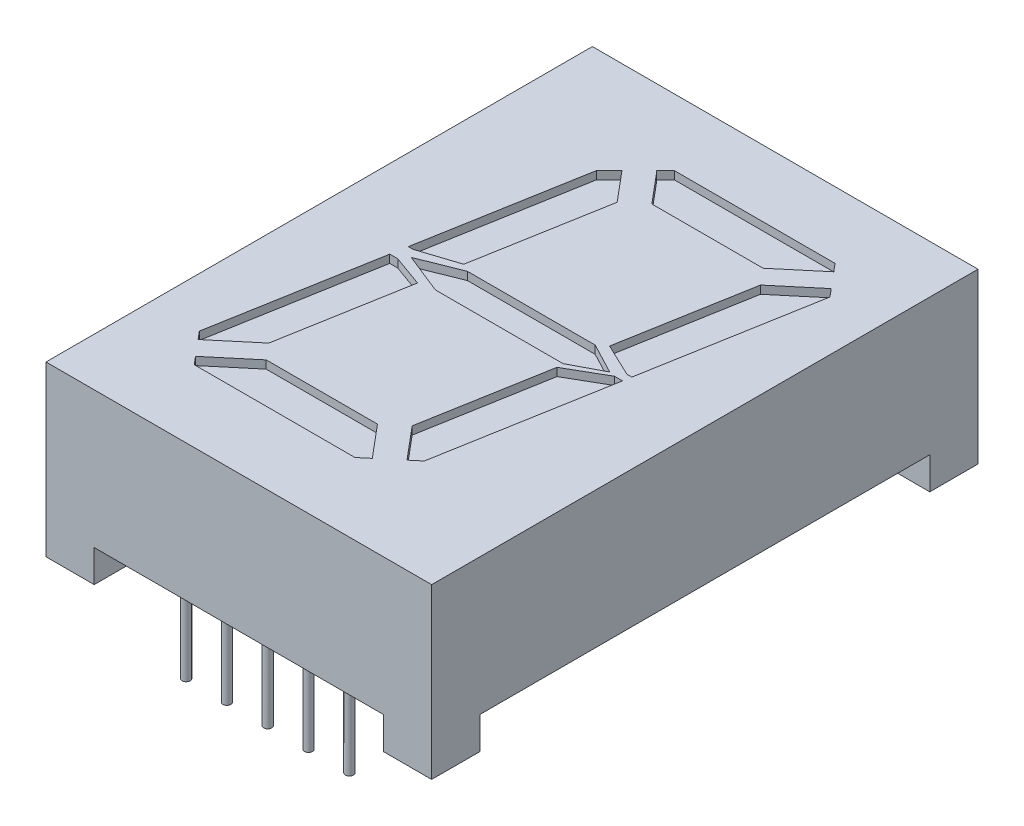
from build123d import *

# Parameters (mm, degrees)
SKETCH1_W           = 24
SKETCH1_H           = 34
BOSS_EXTRUDE1_DEPTH = 10.5
SKETCH3_R           = 0.25
BOSS_EXTRUDE2_DEPTH = 4
SKETCH4_W           = 14
SKETCH4_H           = 2
CUT_EXTRUDE1_DEPTH  = 30
SKETCH5_W           = 9
SKETCH5_H           = 2
CUT_EXTRUDE2_DEPTH  = 43
SKETCH6_R           = 0.25
BOSS_EXTRUDE3_DEPTH = 2
SKETCH7_W           = 7.945226129
SKETCH7_H           = 2
CUT_EXTRUDE3_DEPTH  = 0.5
BOSS_EXTRUDE4_DEPTH = 0.5


with BuildPart() as part:
    # Sketch1 → Boss-Extrude1 (new body)
    with BuildSketch(Plane(origin=(0, 0, 0), x_dir=(1, 0, 0), z_dir=(0, 1, 0))):
        Rectangle(SKETCH1_W, SKETCH1_H)
    extrude(amount=-BOSS_EXTRUDE1_DEPTH)

    # Sketch3 → Boss-Extrude2 (add)
    with BuildSketch(Plane.XZ.offset(10.5)):
        with Locations(Location((0, 15.2, 0), (0, 0, 270))):
            Circle(SKETCH3_R)
        with Locations(Location((0, -15.2, 0), (0, 0, 270))):
            Circle(SKETCH3_R)
        with Locations(Location((2.54, 15.2, 0), (0, 0, 270))):
            Circle(SKETCH3_R)
        with Locations(Location((5.08, 15.2, 0), (0, 0, 270))):
            Circle(SKETCH3_R)
        with Locations(Location((-2.54, 15.2, 0), (0, 0, 90))):
            Circle(SKETCH3_R)
        with Locations(Location((-5.08, 15.2, 0), (0, 0, 90))):
            Circle(SKETCH3_R)
        with Locations(Location((-5.08, -15.2, 0), (0, 0, 270))):
            Circle(SKETCH3_R)
        with Locations(Location((-2.54, -15.2, 0), (0, 0, 270))):
            Circle(SKETCH3_R)
        with Locations(Location((2.54, -15.2, 0), (0, 0, 90))):
            Circle(SKETCH3_R)
        with Locations(Location((5.08, -15.2, 0), (0, 0, 90))):
            Circle(SKETCH3_R)
    extrude(amount=BOSS_EXTRUDE2_DEPTH)

    # Sketch4 → Cut-Extrude1 (cut)
    with BuildSketch(Plane(origin=(12, 0, 0), x_dir=(0, 0, -1), z_dir=(1, 0, 0))):
        with Locations((-7, -9.5)):
            Rectangle(SKETCH4_W, SKETCH4_H)
        with Locations((7, -9.5)):
            Rectangle(SKETCH4_W, SKETCH4_H)
    extrude(amount=-CUT_EXTRUDE1_DEPTH, mode=Mode.SUBTRACT)

    # Sketch5 → Cut-Extrude2 (cut)
    with BuildSketch(Plane.XY.offset(17)):
        with Locations((4.5, -9.5)):
            Rectangle(SKETCH5_W, SKETCH5_H)
        with Locations((-4.5, -9.5)):
            Rectangle(SKETCH5_W, SKETCH5_H)
    extrude(amount=-CUT_EXTRUDE2_DEPTH, mode=Mode.SUBTRACT)


with BuildPart() as cut_extrude2_piece_1:
    # of the separate pieces the step leaves, piece 1, a body of its own (cut_extrude2_pieces)
    add(part.part.solids().sort_by_distance((-12, 0, -17))[0])



with BuildPart() as cut_extrude2_piece_2:
    # of the separate pieces the step leaves, piece 2, a body of its own (cut_extrude2_pieces)
    add(part.part.solids().sort_by_distance((5.08, -10.5, -14.95))[0])


with BuildPart() as cut_extrude2_piece_3:
    # of the separate pieces the step leaves, piece 3, a body of its own (cut_extrude2_pieces)
    add(part.part.solids().sort_by_distance((-5.08, -10.5, -15.45))[0])


with BuildPart() as cut_extrude2_piece_4:
    # of the separate pieces the step leaves, piece 4, a body of its own (cut_extrude2_pieces)
    add(part.part.solids().sort_by_distance((5.08, -10.5, 14.95))[0])


with BuildPart() as cut_extrude2_piece_5:
    # of the separate pieces the step leaves, piece 5, a body of its own (cut_extrude2_pieces)
    add(part.part.solids().sort_by_distance((-5.08, -10.5, 15.45))[0])


with BuildPart() as cut_extrude2_piece_6:
    # of the separate pieces the step leaves, piece 6, a body of its own (cut_extrude2_pieces)
    add(part.part.solids().sort_by_distance((0, -10.5, -15.45))[0])


with BuildPart() as cut_extrude2_piece_7:
    # of the separate pieces the step leaves, piece 7, a body of its own (cut_extrude2_pieces)
    add(part.part.solids().sort_by_distance((2.54, -10.5, -14.95))[0])


with BuildPart() as cut_extrude2_piece_8:
    # of the separate pieces the step leaves, piece 8, a body of its own (cut_extrude2_pieces)
    add(part.part.solids().sort_by_distance((-2.54, -10.5, -15.45))[0])


with BuildPart() as cut_extrude2_piece_9:
    # of the separate pieces the step leaves, piece 9, a body of its own (cut_extrude2_pieces)
    add(part.part.solids().sort_by_distance((0, -10.5, 14.95))[0])


with BuildPart() as cut_extrude2_piece_10:
    # of the separate pieces the step leaves, piece 10, a body of its own (cut_extrude2_pieces)
    add(part.part.solids().sort_by_distance((2.54, -10.5, 14.95))[0])


with BuildPart() as cut_extrude2_piece_11:
    # of the separate pieces the step leaves, piece 11, a body of its own (cut_extrude2_pieces)
    add(part.part.solids().sort_by_distance((-2.54, -10.5, 15.45))[0])


with BuildPart() as cut_extrude2_piece_1_1:
    add(cut_extrude2_piece_1.part)

    add(cut_extrude2_piece_2.part)  # Boss-Extrude3 merges Cut-Extrude2 piece 2

    add(cut_extrude2_piece_3.part)  # Boss-Extrude3 merges Cut-Extrude2 piece 3

    add(cut_extrude2_piece_4.part)  # Boss-Extrude3 merges Cut-Extrude2 piece 4

    add(cut_extrude2_piece_5.part)  # Boss-Extrude3 merges Cut-Extrude2 piece 5

    add(cut_extrude2_piece_6.part)  # Boss-Extrude3 merges Cut-Extrude2 piece 6

    add(cut_extrude2_piece_7.part)  # Boss-Extrude3 merges Cut-Extrude2 piece 7

    add(cut_extrude2_piece_8.part)  # Boss-Extrude3 merges Cut-Extrude2 piece 8

    add(cut_extrude2_piece_9.part)  # Boss-Extrude3 merges Cut-Extrude2 piece 9

    add(cut_extrude2_piece_10.part)  # Boss-Extrude3 merges Cut-Extrude2 piece 10

    add(cut_extrude2_piece_11.part)  # Boss-Extrude3 merges Cut-Extrude2 piece 11
    # Sketch6 → Boss-Extrude3 (add)
    with BuildSketch(Plane(origin=(0, -10.5, 0), x_dir=(1, 0, 0), z_dir=(0, 1, 0))):
        with Locations(Location((0, -15.2, 0), (0, 0, 90))):
            Circle(SKETCH6_R)
        with Locations(Location((2.54, -15.2, 0), (0, 0, 90))):
            Circle(SKETCH6_R)
        with Locations(Location((5.08, -15.2, 0), (0, 0, 90))):
            Circle(SKETCH6_R)
        with Locations(Location((-5.08, -15.2, 0), (0, 0, 270))):
            Circle(SKETCH6_R)
        with Locations(Location((-2.54, -15.2, 0), (0, 0, 270))):
            Circle(SKETCH6_R)
        with Locations(Location((5.08, 15.2, 0), (0, 0, 270))):
            Circle(SKETCH6_R)
        with Locations(Location((2.54, 15.2, 0), (0, 0, 270))):
            Circle(SKETCH6_R)
        with Locations(Location((0, 15.2, 0), (0, 0, 90))):
            Circle(SKETCH6_R)
        with Locations(Location((-2.54, 15.2, 0), (0, 0, 90))):
            Circle(SKETCH6_R)
        with Locations(Location((-5.08, 15.2, 0), (0, 0, 90))):
            Circle(SKETCH6_R)
    extrude(amount=BOSS_EXTRUDE3_DEPTH)

    # Sketch7 → Cut-Extrude3 (cut)
    with BuildSketch(Plane(origin=(0, 0, 0), x_dir=(1, 0, 0), z_dir=(0, 1, 0))):
        Polygon((-5.188795352, 10.437162232), (-6.942324566, 0.492403877), (-6.642324566, 0.492403877), (-4.266955967, 1.26824697), (-2.836546445, 9.380502486), (-4.385166656, 11.226076186), (-3.211518478, 12.210883939), (-1.662898267, 10.365310239), (5.259968674, 10.365310239), (7.55683761, 12.292612116), (8.383189432, 11.307804363), (6.086320496, 9.380502486), (4.678270162, 1.395052228), (6.743412044, 0.411512177), (7.043412044, 0.411512177), (8.8920563, 10.895694733), (7.239352655, 12.865310239), (-2.760647345, 12.865310239), align=None)
        Polygon((-8.8920563, -10.565074255), (-8.478880388, -11.057478132), (-6.086320496, -9.049882008), (-4.698885284, -1.181345914), (-6.615972744, -0.492403877), (-7.115972744, -0.492403877), align=None)
        Polygon((-7.652528566, -12.042285885), (-7.239352655, -12.534689761), (2.760647345, -12.534689761), (3.347471434, -12.042285885), (1.662898267, -10.034689761), (-5.259968674, -10.034689761), align=None)
        Polygon((2.836546445, -9.049882008), (4.521119612, -11.057478132), (5.1079437, -10.565074255), (6.956587956, -0.080891699), (6.456587956, -0.080891699), (4.187465262, -1.388440678), align=None)
        with Locations((0.205657098, -0.000503087)):
            Rectangle(SKETCH7_W, SKETCH7_H)
        Polygon((-4.355746064, 0.764693302), (-4.607811486, -0.664840738), (-3.766955967, -1.000503087), (-3.766955967, 0.999496913), align=None)
        Polygon((-6.273279795, 0), (-4.607811486, -0.664840738), (-4.355746064, 0.764693302), align=None)
        Polygon((4.178270162, -1.000503087), (4.263800752, -0.955520605), (4.57204349, 0.792610834), (4.178270162, 0.999496913), align=None)
        Polygon((4.57204349, 0.792610834), (4.263800752, -0.955520605), (6.080646714, 0), align=None)
    extrude(amount=-CUT_EXTRUDE3_DEPTH, mode=Mode.SUBTRACT)

    # Sketch8 → Boss-Extrude4 (add)
    with BuildSketch(Plane(origin=(0, -0.5, 0), x_dir=(1, 0, 0), z_dir=(0, 1, 0))):
        Polygon((7.55683761, 12.292612116), (7.652528566, 12.372906362), (8.478880388, 11.388098609), (8.383189432, 11.307804363), align=None)
        Polygon((-4.385166656, 11.226076186), (-4.392524027, 11.233433557), (-3.313296062, 12.312661522), (-3.211518478, 12.210883939), align=None)
    extrude(amount=BOSS_EXTRUDE4_DEPTH)


solid = cut_extrude2_piece_1_1.part
